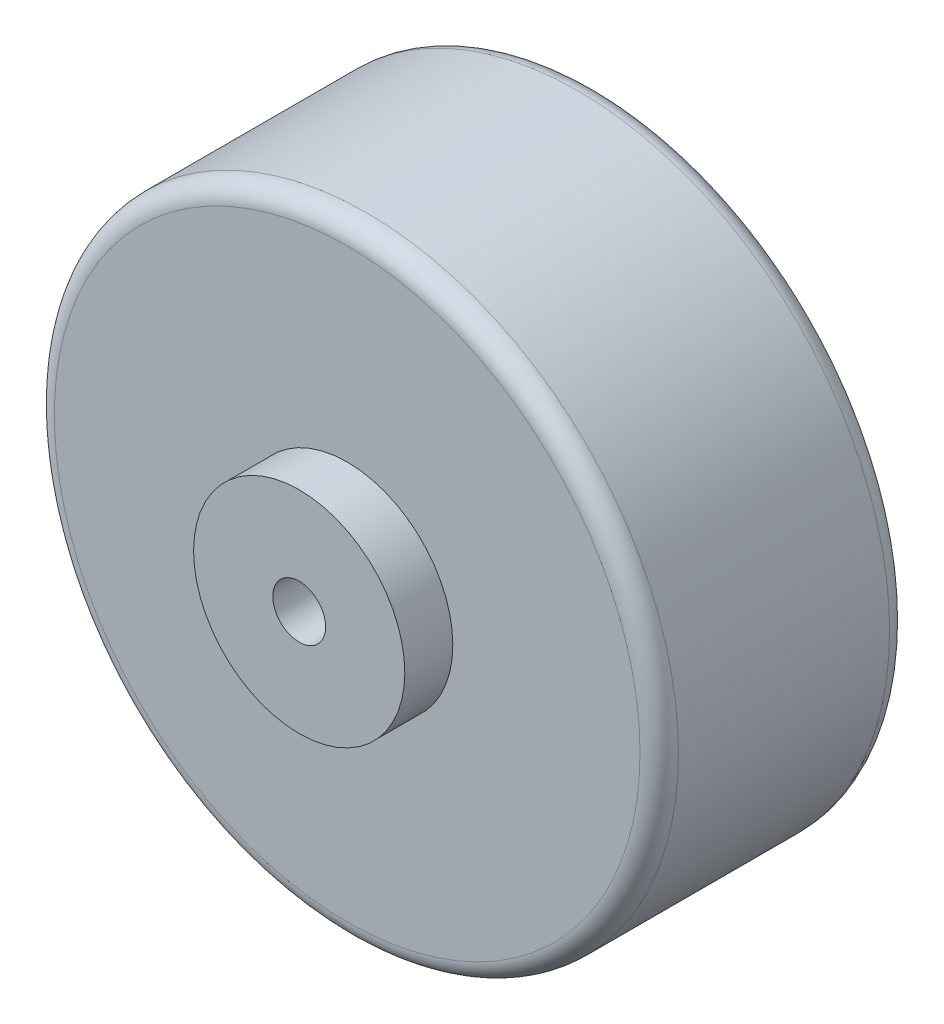
from build123d import *

# Parameters (mm, degrees)
SKETCH1_R           = 32.5
BOSS_EXTRUDE1_DEPTH = 26
SKETCH2_R           = 11
BOSS_EXTRUDE2_DEPTH = 5
SKETCH3_R           = 2.75
CUT_EXTRUDE1_DEPTH  = 56.439155838
FILLET1_R           = 2


with BuildPart() as part:
    # Sketch1 → Boss-Extrude1 (new body)
    with BuildSketch(Plane.XY):
        with Locations(Location((0, 0, 0), (0, 0, 180))):
            Circle(SKETCH1_R)
    extrude(amount=BOSS_EXTRUDE1_DEPTH)

    # Sketch2 → Boss-Extrude2 (add)
    with BuildSketch(Plane.XY.offset(26)):
        Circle(SKETCH2_R)
    extrude(amount=BOSS_EXTRUDE2_DEPTH)

    # Sketch3 → Cut-Extrude1 (cut, through all)
    with BuildSketch(Plane.XY.offset(31)):
        Circle(SKETCH3_R)
    extrude(amount=-CUT_EXTRUDE1_DEPTH, mode=Mode.SUBTRACT)

    # Fillet1
    fillet1_edges = [part.edges().sort_by_distance(p)[0] for p in [
        (32.5, 0, 0),
        (32.5, 0, 26),
    ]]
    fillet(fillet1_edges, radius=FILLET1_R)


solid = part.part
